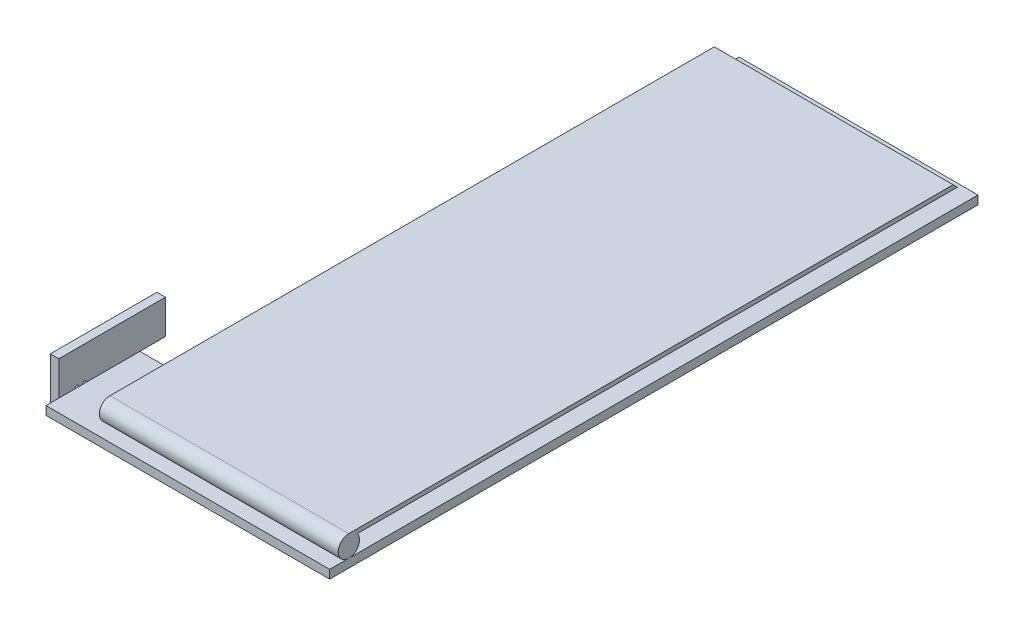
from build123d import *

# Parameters (mm, degrees)
BOSS_EXTRUDE1_DEPTH = 2
SKETCH2_W           = 25
SKETCH2_H           = 8
BOSS_EXTRUDE2_DEPTH = 2
SKETCH3_R           = 0.361818182
CUT_EXTRUDE1_DEPTH  = 2
BOSS_EXTRUDE4_DEPTH = 28


with BuildPart() as part:
    # Sketch1 → Boss-Extrude1 (new body)
    with BuildSketch(Plane(origin=(0, 0, 0), x_dir=(1, 0, 0), z_dir=(0, 1, 0))):
        Polygon((-30, -74.5), (-28, -74.5), (-28, -77.5), (38.5, -77.5), (38.5, 74.5), (-17.503169207, 74.5), (-17.503169207, -55.5), (-30, -55.5), align=None)
    extrude(amount=BOSS_EXTRUDE1_DEPTH)

    # Sketch2 → Boss-Extrude2 (add)
    with BuildSketch(Plane.ZY.offset(30)):
        with Locations((62, 6)):
            Rectangle(SKETCH2_W, SKETCH2_H)
    extrude(amount=-BOSS_EXTRUDE2_DEPTH)

    # Sketch3 → Cut-Extrude1 (cut)
    with BuildSketch(Plane.ZY.offset(30)):
        with Locations((68.455544804, 2.134454992)):
            Circle(SKETCH3_R)
        with Locations((70.264435843, 2.134454992)):
            Circle(SKETCH3_R)
    extrude(amount=-CUT_EXTRUDE1_DEPTH, mode=Mode.SUBTRACT)


with BuildPart() as body_2:
    # Sketch4 → Boss-Extrude4 (new, symmetric)
    with BuildSketch(Plane(origin=(10.5, 0, 0), x_dir=(0, 0, -1), z_dir=(1, 0, 0))):
        with BuildLine():
            Line((68.671572875, 7), (69.671572875, 6))
            Line((69.671572875, 6), (-71, 6))
            ThreePointArc((-71, 6), (-74.118033989, 2.263932023), (-73, 7))
            Line((-73, 7), (68.671572875, 7))
        make_face()
    extrude(amount=BOSS_EXTRUDE4_DEPTH, both=True)


solid = Compound([part.part, body_2.part])
